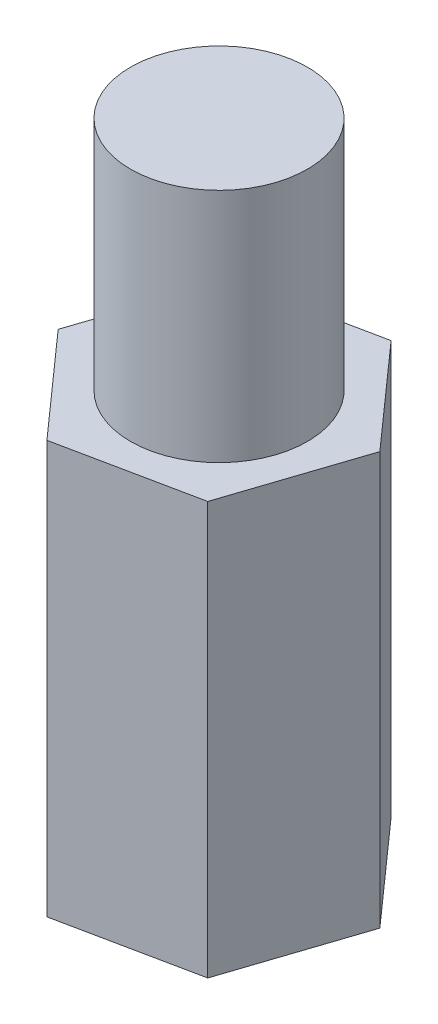
from build123d import *

# Parameters (mm, degrees)
SKETCH1_R           = 1.5
BOSS_EXTRUDE1_DEPTH = 4
BOSS_EXTRUDE2_DEPTH = 7
SKETCH3_R           = 1
CUT_EXTRUDE1_DEPTH  = 4


with BuildPart() as part:
    # Sketch1 → Boss-Extrude1 (new body)
    with BuildSketch(Plane(origin=(0, 0, 0), x_dir=(1, 0, 0), z_dir=(0, 1, 0))):
        with Locations(Location((0, 0, 0), (0, 0, 270))):
            Circle(SKETCH1_R)
    extrude(amount=BOSS_EXTRUDE1_DEPTH)

    # Sketch2 → Boss-Extrude2 (add)
    with BuildSketch(Plane(origin=(0, 0, 0), x_dir=(1, 0, 0), z_dir=(0, 1, 0))):
        Polygon((1.534673451, -1.725720351), (2.26185439, 0.46620602), (0.727180939, 2.191926371), (-1.534673451, 1.725720351), (-2.26185439, -0.46620602), (-0.727180939, -2.191926371), align=None)
    extrude(amount=-BOSS_EXTRUDE2_DEPTH)

    # Sketch3 → Cut-Extrude1 (cut)
    with BuildSketch(Plane.XZ.offset(7)):
        with Locations(Location((0, 0, 0), (0, 0, 270))):
            Circle(SKETCH3_R)
    extrude(amount=-CUT_EXTRUDE1_DEPTH, mode=Mode.SUBTRACT)


solid = part.part
